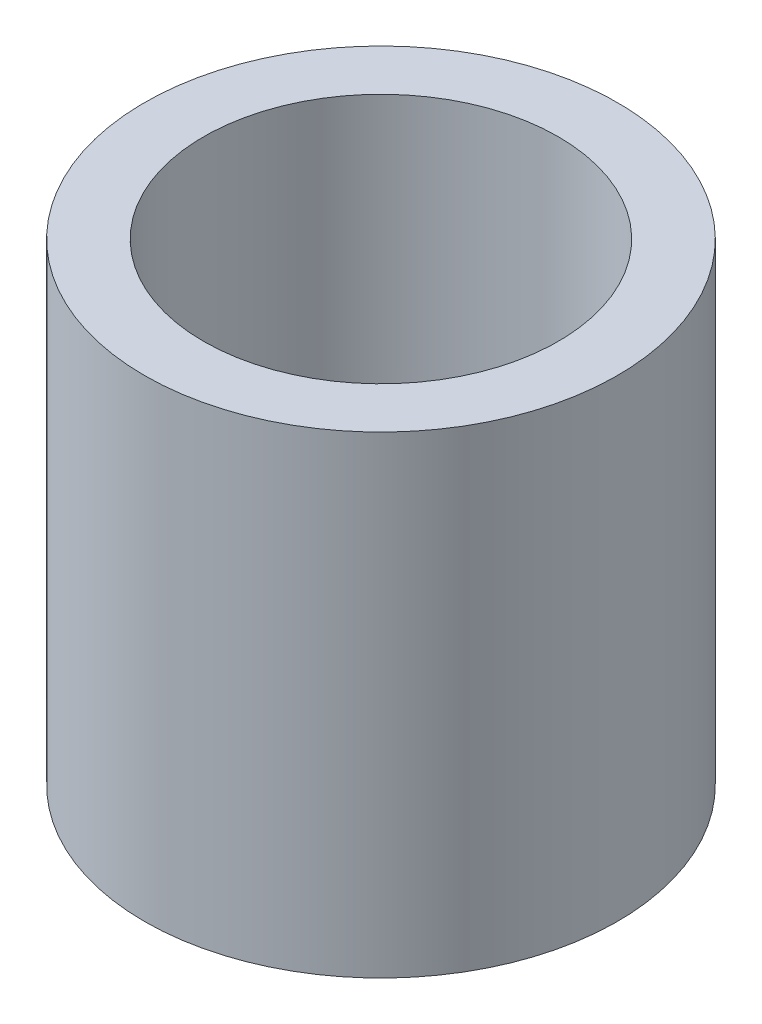
from build123d import *

# Parameters (mm, degrees)
SKETCH1_R           = 6.35
BOSS_EXTRUDE1_DEPTH = 12.7
SKETCH2_R           = 4.7625
CUT_EXTRUDE1_DEPTH  = 16.554259867


with BuildPart() as part:
    # Sketch1 → Boss-Extrude1 (new body)
    with BuildSketch(Plane(origin=(0, 0, 0), x_dir=(1, 0, 0), z_dir=(0, 1, 0))):
        with Locations(Location((0, 0, 0), (0, 0, 270))):
            Circle(SKETCH1_R)
    extrude(amount=BOSS_EXTRUDE1_DEPTH)

    # Sketch2 → Cut-Extrude1 (cut, through all)
    with BuildSketch(Plane(origin=(0, 12.7, 0), x_dir=(1, 0, 0), z_dir=(0, 1, 0))):
        with Locations(Location((0, 0, 0), (0, 0, 270))):
            Circle(SKETCH2_R)
    extrude(amount=-CUT_EXTRUDE1_DEPTH, mode=Mode.SUBTRACT)


solid = part.part
